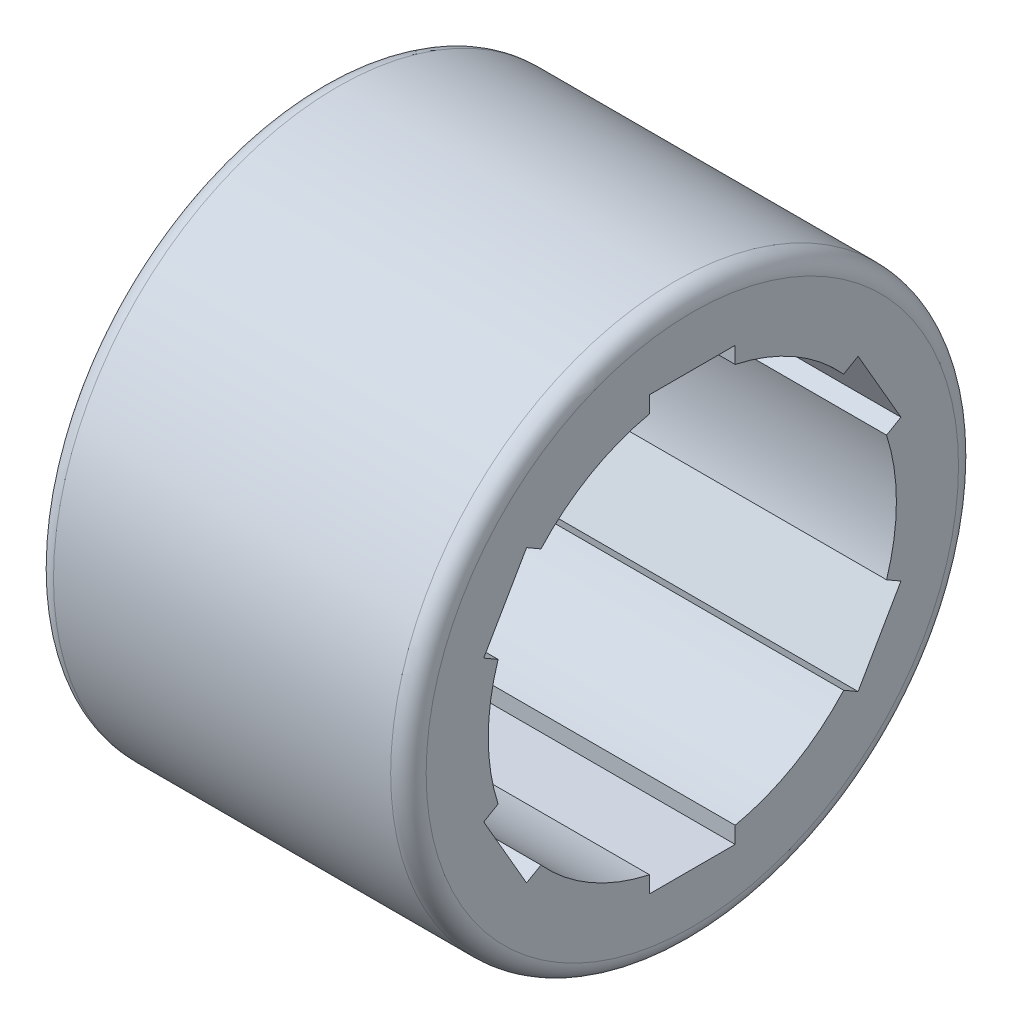
from build123d import *

# Parameters (mm, degrees)
CROQUIS1_R              = 16
SALIENTE_EXTRUIR1_DEPTH = 21
REDONDEO1_R             = 1


with BuildPart() as part:
    # Croquis1 → Saliente-Extruir1 (new body)
    with BuildSketch(Plane(origin=(0, 0, 0), x_dir=(0, 0, -1), z_dir=(1, 0, 0))):
        with Locations(Location((0, 0, 0), (0, 0, 180))):
            Circle(CROQUIS1_R)
        with BuildLine():
            Line((9.340689418, 8.18145135), (11.755689418, 3.99854865))
            Line((11.755689418, 3.99854865), (10.944713731, 3.530331619))
            ThreePointArc((10.944713731, 3.530331619), (11.5, 0), (10.944713731, -3.530331619))
            Line((10.944713731, -3.530331619), (11.755689418, -3.99854865))
            Line((11.755689418, -3.99854865), (9.340689418, -8.18145135))
            Line((9.340689418, -8.18145135), (8.529713731, -7.713234319))
            ThreePointArc((8.529713731, -7.713234319), (5.75, -9.959292144), (2.415, -11.243565938))
            Line((2.415, -11.243565938), (2.415, -12.18))
            Line((2.415, -12.18), (-2.415, -12.18))
            Line((-2.415, -12.18), (-2.415, -11.243565938))
            ThreePointArc((-2.415, -11.243565938), (-5.75, -9.959292144), (-8.529713731, -7.713234319))
            Line((-8.529713731, -7.713234319), (-9.340689418, -8.18145135))
            Line((-9.340689418, -8.18145135), (-11.755689418, -3.99854865))
            Line((-11.755689418, -3.99854865), (-10.944713731, -3.530331619))
            ThreePointArc((-10.944713731, -3.530331619), (-11.5, 0), (-10.944713731, 3.530331619))
            Line((-10.944713731, 3.530331619), (-11.755689418, 3.99854865))
            Line((-11.755689418, 3.99854865), (-9.340689418, 8.18145135))
            Line((-9.340689418, 8.18145135), (-8.529713731, 7.713234319))
            ThreePointArc((-8.529713731, 7.713234319), (-5.75, 9.959292144), (-2.415, 11.243565938))
            Line((-2.415, 11.243565938), (-2.415, 12.18))
            Line((-2.415, 12.18), (2.415, 12.18))
            Line((2.415, 12.18), (2.415, 11.243565938))
            ThreePointArc((2.415, 11.243565938), (5.75, 9.959292144), (8.529713731, 7.713234319))
            Line((8.529713731, 7.713234319), (9.340689418, 8.18145135))
        make_face(mode=Mode.SUBTRACT)
    extrude(amount=SALIENTE_EXTRUIR1_DEPTH)

    # Redondeo1
    redondeo1_edges = [part.edges().sort_by_distance(p)[0] for p in [
        (0, 0, -16),
        (21, 0, -16),
    ]]
    fillet(redondeo1_edges, radius=REDONDEO1_R)


solid = part.part
